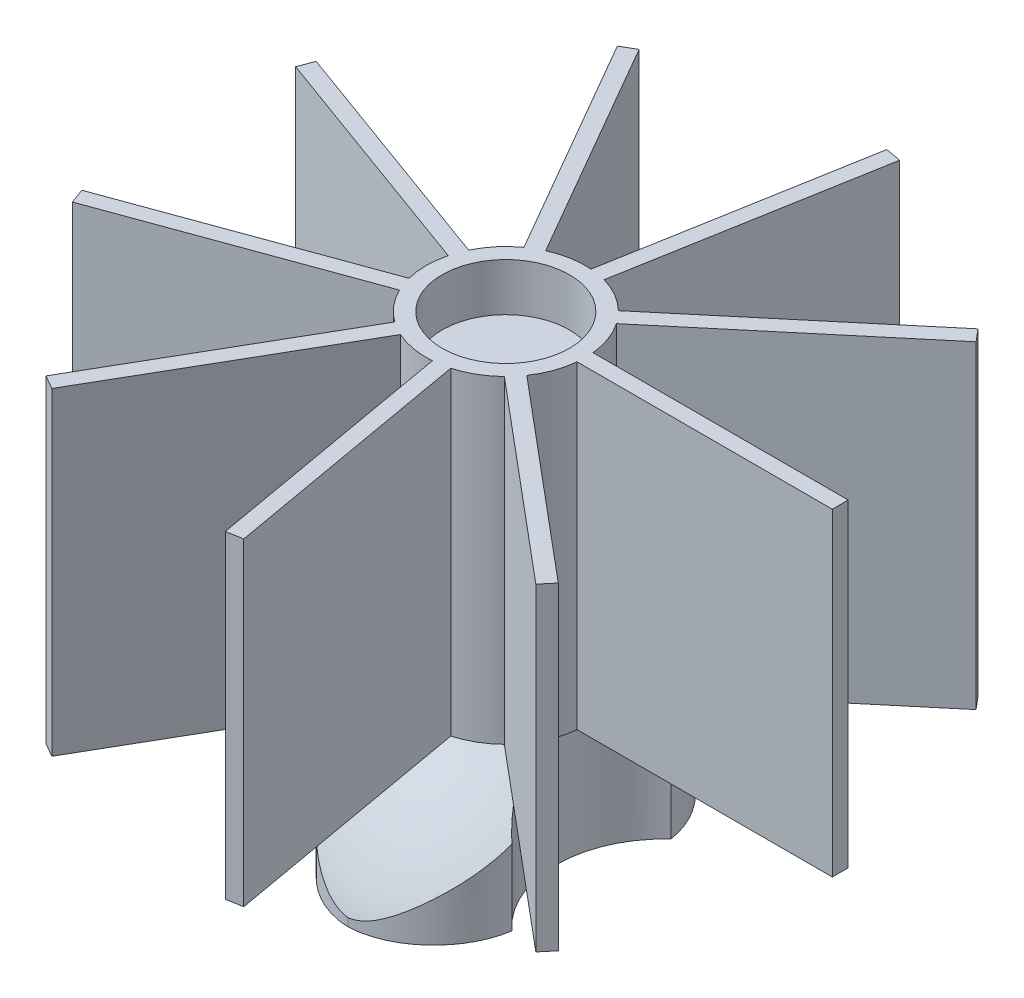
from build123d import *

# Parameters (mm, degrees)
SKETCH1_R           = 5
SKETCH1_R_2         = 3
BOSS_EXTRUDE2_DEPTH = 17.5
SKETCH4_W           = 18
SKETCH4_H           = 1
EXTRUDE_THIN1_DEPTH = 35
CIRPATTERN1_COUNT   = 9
SKETCH5_R           = 3
BOSS_EXTRUDE3_DEPTH = 15
SKETCH6_R           = 3.5
SKETCH6_R_2         = 1.5
CUT_EXTRUDE1_DEPTH  = 6
SKETCH15_R          = 1.5
CUT_EXTRUDE2_DEPTH  = 2
SKETCH17_R          = 2.5
BOSS_EXTRUDE4_DEPTH = 3
SKETCH18_R          = 2
CUT_EXTRUDE3_DEPTH  = 2
SKETCH19_R          = 4
CUT_EXTRUDE4_DEPTH  = 20
SKETCH20_W          = 45.677284088
SKETCH20_H          = 45.724664858
CUT_EXTRUDE5_DEPTH  = 8
SKETCH21_R          = 3
BOSS_EXTRUDE5_DEPTH = 1
SKETCH24_R          = 9.912143672
BOSS_EXTRUDE6_DEPTH = 0.5
SKETCH25_R          = 3.2
CUT_EXTRUDE6_DEPTH  = 2.1
SKETCH26_R          = 3.2
BOSS_EXTRUDE7_DEPTH = 0.25
CUT_EXTRUDE8_START  = -7.5
CUT_EXTRUDE8_DEPTH  = 7.5
SKETCH28_R          = 0.5
CUT_EXTRUDE9_DEPTH  = 1.5
CUT_EXTRUDE10_DEPTH = 7
BOSS_EXTRUDE8_START = 10
SKETCH30_R          = 4
BOSS_EXTRUDE8_DEPTH = 10


with BuildPart() as part:
    # Sketch1 → Boss-Extrude2 (new, symmetric)
    with BuildSketch(Plane(origin=(0, 0, 0), x_dir=(1, 0, 0), z_dir=(0, 1, 0))):
        with Locations(Location((0, 0, 0), (0, 0, 270))):
            Circle(SKETCH1_R)
        with Locations(Location((0, 0, 0), (0, 0, 270))):
            Circle(SKETCH1_R_2, mode=Mode.SUBTRACT)
    extrude(amount=BOSS_EXTRUDE2_DEPTH, both=True)

    # Sketch4 → Extrude-Thin1 (add)
    with BuildSketch(Plane(origin=(0, 17.5, 0), x_dir=(1, 0, 0), z_dir=(0, 1, 0))):
        with Locations((12, 0)):
            Rectangle(SKETCH4_W, SKETCH4_H)
    extrude_thin1 = extrude(amount=-EXTRUDE_THIN1_DEPTH)

    # CirPattern1: Extrude-Thin1 ×9 about axis
    cirpattern1_axis = Axis((0, 0, 0), (0, 1, 0))
    for i in range(1, CIRPATTERN1_COUNT):
        add(extrude_thin1.rotate(cirpattern1_axis, i * 360 / CIRPATTERN1_COUNT))

    # Sketch5 → Boss-Extrude3 (add)
    with BuildSketch(Plane(origin=(0, -17.5, 0), x_dir=(-1, 0, 0), z_dir=(0, -1, 0))):
        with Locations(Location((0, 0, 0), (0, 0, 90))):
            Circle(SKETCH5_R)
    extrude(amount=-BOSS_EXTRUDE3_DEPTH)

    # Sketch6 → Cut-Extrude1 (cut)
    with BuildSketch(Plane(origin=(0, -17.5, 0), x_dir=(-1, 0, 0), z_dir=(0, -1, 0))):
        with Locations(Location((0, 0, 0), (0, 0, 90))):
            Circle(SKETCH6_R)
        with Locations(Location((0, 0, 0), (0, 0, 90))):
            Circle(SKETCH6_R_2, mode=Mode.SUBTRACT)
    extrude(amount=-CUT_EXTRUDE1_DEPTH, mode=Mode.SUBTRACT)

    # Sketch15 → Cut-Extrude2 (cut)
    with BuildSketch(Plane.XZ.offset(17.5)):
        with Locations(Location((0, 0, 0), (0, 0, 270))):
            Circle(SKETCH15_R)
    extrude(amount=-CUT_EXTRUDE2_DEPTH, mode=Mode.SUBTRACT)

    # Sketch17 → Boss-Extrude4 (add)
    with BuildSketch(Plane.XZ.offset(17.5)):
        with Locations((18.5, 0)):
            Circle(SKETCH17_R)
    extrude(amount=-BOSS_EXTRUDE4_DEPTH)

    # Sketch18 → Cut-Extrude3 (cut)
    with BuildSketch(Plane.XZ.offset(17.5)):
        with Locations(Location((18.5, 0, 0), (0, 0, 270))):
            Circle(SKETCH18_R)
    extrude(amount=-CUT_EXTRUDE3_DEPTH, mode=Mode.SUBTRACT)

    # Sketch19 → Cut-Extrude4 (cut)
    with BuildSketch(Plane(origin=(0, 17.5, 0), x_dir=(1, 0, 0), z_dir=(0, 1, 0))):
        with Locations(Location((0, 0, 0), (0, 0, 270))):
            Circle(SKETCH19_R)
    extrude(amount=-CUT_EXTRUDE4_DEPTH, mode=Mode.SUBTRACT)

    # Sketch20 → Cut-Extrude5 (cut)
    with BuildSketch(Plane(origin=(0, -17.5, 0), x_dir=(-1, 0, 0), z_dir=(0, -1, 0))):
        Rectangle(SKETCH20_W, SKETCH20_H)
    extrude(amount=-CUT_EXTRUDE5_DEPTH, mode=Mode.SUBTRACT)

    # Sketch21 → Boss-Extrude5 (add)
    with BuildSketch(Plane.XZ.offset(9.5)):
        with Locations(Location((0, 0, 0), (0, 0, 90))):
            Circle(SKETCH21_R)
    extrude(amount=BOSS_EXTRUDE5_DEPTH)

    # Sketch23 → Revolve1 (revolve)
    with BuildSketch(Plane(origin=(0, 0, 0), x_dir=(0, 0, -1), z_dir=(1, 0, 0))):
        with BuildLine():
            Line((-3, -10.5), (-2, -10.5))
            Line((-2, -10.5), (0, -10.5))
            Line((0, -10.5), (0, -17.5))
            Line((0, -17.5), (-8.912143672, -17.5))
            Line((-8.912143672, -17.5), (-9.912143672, -17.5))
            ThreePointArc((-9.912143672, -17.5), (-7.260403323, -13.2057636), (-3, -10.5))
        make_face()
    revolve(axis=Axis((0, -11.130650603, 0), (0, -1, 0)))

    # Sketch24 → Boss-Extrude6 (add)
    with BuildSketch(Plane.XZ.offset(17.5)):
        with Locations(Location((0, 0, 0), (0, 0, 270))):
            Circle(SKETCH24_R)
    extrude(amount=BOSS_EXTRUDE6_DEPTH)

    # Sketch25 → Cut-Extrude6 (cut)
    with BuildSketch(Plane.XZ.offset(18)):
        with Locations(Location((-0.56668442, 5, 0), (0, 0, 270))):
            Circle(SKETCH25_R)
    extrude(amount=-CUT_EXTRUDE6_DEPTH, mode=Mode.SUBTRACT)

    # Sketch26 → Boss-Extrude7 (add)
    with BuildSketch(Plane.XZ.offset(18)):
        with Locations(Location((-0.56668442, 5, 0), (0, 0, 270))):
            Circle(SKETCH26_R)
    extrude(amount=-BOSS_EXTRUDE7_DEPTH)

    # Sketch27 → Cut-Extrude8 (cut)
    with BuildSketch(Plane.XZ.offset(18).offset(CUT_EXTRUDE8_START)):
        with BuildLine():
            ThreePointArc((-5.368630905, 4.991892601), (-6.424807204, 5.779358473), (-7.613826501, 6.346671425))
            ThreePointArc((-7.613826501, 6.346671425), (-9.912143672, 0), (-7.613826501, -6.346671425))
            ThreePointArc((-7.613826501, -6.346671425), (-6.424807204, -5.779358473), (-5.368630905, -4.991892601))
            ThreePointArc((-5.368630905, -4.991892601), (-3.162143672, 0), (-5.368630905, 4.991892601))
        make_face()
        with BuildLine():
            ThreePointArc((9.912143672, 0), (9.319869483, 3.375), (7.613826501, 6.346671425))
            ThreePointArc((7.613826501, 6.346671425), (6.424807204, 5.779358473), (5.368630905, 4.991892601))
            ThreePointArc((5.368630905, 4.991892601), (3.162143672, 0), (5.368630905, -4.991892601))
            ThreePointArc((5.368630905, -4.991892601), (6.424807204, -5.779358473), (7.613826501, -6.346671425))
            ThreePointArc((7.613826501, -6.346671425), (9.319869483, -3.375), (9.912143672, 0))
        make_face()
        with BuildLine():
            ThreePointArc((-5.368630905, -4.991892601), (-6.424807204, -5.779358473), (-7.613826501, -6.346671425))
            ThreePointArc((-7.613826501, -6.346671425), (-4.203657524, -8.976628297), (0, -9.912143672))
            add(Edge.make_bspline(
                [(-5.368630905, -4.991892601), (-4.998119196, -7.539682857), (-2.616364035, -9.837937814), (0, -9.912143672)],
                knots=[0, 0, 0, 0, 1, 1, 1, 1], degree=3))
        make_face()
        with BuildLine():
            add(Edge.make_bspline(
                [(5.368630905, -4.991892601), (4.998119196, -7.539682857), (2.616364035, -9.837937814), (0, -9.912143672)],
                knots=[0, 0, 0, 0, 1, 1, 1, 1], degree=3))
            ThreePointArc((0, -9.912143672), (4.203657524, -8.976628297), (7.613826501, -6.346671425))
            ThreePointArc((7.613826501, -6.346671425), (6.424807204, -5.779358473), (5.368630905, -4.991892601))
        make_face()
        with BuildLine():
            ThreePointArc((0, 9.912143672), (-4.203657524, 8.976628297), (-7.613826501, 6.346671425))
            ThreePointArc((-7.613826501, 6.346671425), (-6.424807204, 5.779358473), (-5.368630905, 4.991892601))
            add(Edge.make_bspline(
                [(-5.368630905, 4.991892601), (-4.998119196, 7.539682857), (-2.616364035, 9.837937814), (0, 9.912143672)],
                knots=[0, 0, 0, 0, 1, 1, 1, 1], degree=3))
        make_face()
        with BuildLine():
            ThreePointArc((7.613826501, 6.346671425), (4.203657524, 8.976628297), (0, 9.912143672))
            add(Edge.make_bspline(
                [(5.368630905, 4.991892601), (4.998119196, 7.539682857), (2.616364035, 9.837937814), (0, 9.912143672)],
                knots=[0, 0, 0, 0, 1, 1, 1, 1], degree=3))
            ThreePointArc((5.368630905, 4.991892601), (6.424807204, 5.779358473), (7.613826501, 6.346671425))
        make_face()
    extrude(amount=CUT_EXTRUDE8_DEPTH, mode=Mode.SUBTRACT)

    # Sketch28 → Cut-Extrude9 (cut)
    with BuildSketch(Plane.XZ.offset(18)):
        with Locations(Location((0, 0, 0), (0, 0, 270))):
            Circle(SKETCH28_R)
    extrude(amount=-CUT_EXTRUDE9_DEPTH, mode=Mode.SUBTRACT)

    # Sketch29 → Cut-Extrude10 (cut)
    with BuildSketch(Plane(origin=(0, 17.5, 0), x_dir=(1, 0, 0), z_dir=(0, 1, 0))):
        with BuildLine():
            Line((3.489629181, -3.580850203), (15.765539501, -13.881562025))
            Line((15.765539501, -13.881562025), (16.40832711, -13.115517582))
            Line((16.40832711, -13.115517582), (4.132416791, -2.81480576))
            ThreePointArc((4.132416791, -2.81480576), (4.698463104, -1.710100717), (4.974937186, -0.5))
            Line((4.974937186, -0.5), (21, -0.5))
            Line((21, -0.5), (21, 0.5))
            Line((21, 0.5), (4.974937186, 0.5))
            ThreePointArc((4.974937186, 0.5), (4.698463104, 1.710100717), (4.132416791, 2.81480576))
            Line((4.132416791, 2.81480576), (16.40832711, 13.115517582))
            Line((16.40832711, 13.115517582), (15.765539501, 13.881562025))
            Line((15.765539501, 13.881562025), (3.489629181, 3.580850203))
            ThreePointArc((3.489629181, 3.580850203), (2.5, 4.330127019), (1.356292653, 4.812532622))
            Line((1.356292653, 4.812532622), (4.139015608, 20.594138724))
            Line((4.139015608, 20.594138724), (3.154207854, 20.767786902))
            Line((3.154207854, 20.767786902), (0.3714849, 4.9861808))
            ThreePointArc((0.3714849, 4.9861808), (-0.868240888, 4.924038765), (-2.054455891, 4.558421985))
            Line((-2.054455891, 4.558421985), (-10.066987298, 18.436533479))
            Line((-10.066987298, 18.436533479), (-10.933012702, 17.936533479))
            Line((-10.933012702, 17.936533479), (-2.920481295, 4.058421985))
            ThreePointArc((-2.920481295, 4.058421985), (-3.830222216, 3.213938048), (-4.50390169, 2.17137504))
            Line((-4.50390169, 2.17137504), (-19.562534965, 7.65226932))
            Line((-19.562534965, 7.65226932), (-19.904555108, 6.712576699))
            Line((-19.904555108, 6.712576699), (-4.845921834, 1.231682419))
            ThreePointArc((-4.845921834, 1.231682419), (-5, 0), (-4.845921834, -1.231682419))
            Line((-4.845921834, -1.231682419), (-19.904555108, -6.712576699))
            Line((-19.904555108, -6.712576699), (-19.562534965, -7.65226932))
            Line((-19.562534965, -7.65226932), (-4.50390169, -2.17137504))
            ThreePointArc((-4.50390169, -2.17137504), (-3.830222216, -3.213938048), (-2.920481295, -4.058421985))
            Line((-2.920481295, -4.058421985), (-10.933012702, -17.936533479))
            Line((-10.933012702, -17.936533479), (-10.066987298, -18.436533479))
            Line((-10.066987298, -18.436533479), (-2.054455891, -4.558421985))
            ThreePointArc((-2.054455891, -4.558421985), (-0.868240888, -4.924038765), (0.3714849, -4.9861808))
            Line((0.3714849, -4.9861808), (3.154207854, -20.767786902))
            Line((3.154207854, -20.767786902), (4.139015608, -20.594138724))
            Line((4.139015608, -20.594138724), (1.356292653, -4.812532622))
            ThreePointArc((1.356292653, -4.812532622), (2.5, -4.330127019), (3.489629181, -3.580850203))
        make_face()
    extrude(amount=-CUT_EXTRUDE10_DEPTH, mode=Mode.SUBTRACT)

    # Sketch30 → Boss-Extrude8 (add)
    with BuildSketch(Plane(origin=(0, -2.5, 0), x_dir=(1, 0, 0), z_dir=(0, 1, 0)).offset(BOSS_EXTRUDE8_START)):
        with Locations(Location((0, 0, 0), (0, 0, 270))):
            Circle(SKETCH30_R)
    extrude(amount=-BOSS_EXTRUDE8_DEPTH)


solid = part.part
